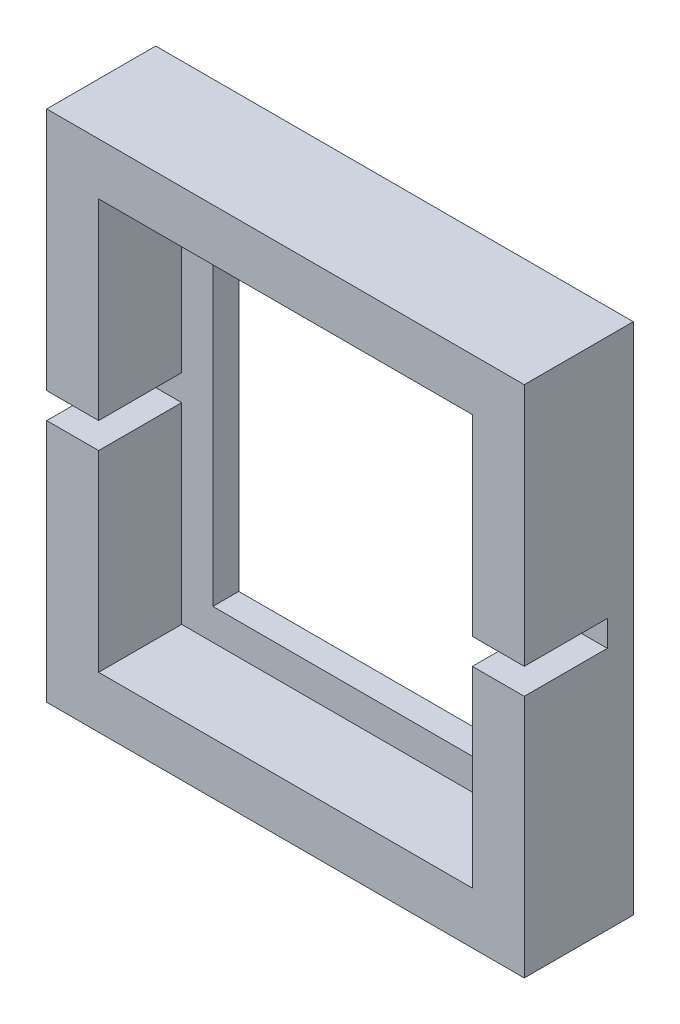
from build123d import *

# Parameters (mm, degrees)
BOSS_EXTRUDE1_DEPTH   = 8
BOSS_EXTRUDE1_2_DEPTH = 8
SKETCH2_W             = 46
SKETCH2_H             = 49.5
SKETCH2_W_2           = 30
SKETCH2_H_2           = 33.5
BOSS_EXTRUDE2_DEPTH   = 2.5


with BuildPart() as part:
    # Sketch1 → Boss-Extrude1 (new body)
    with BuildSketch(Plane.XY):
        Polygon((-5, 21), (0, 21), (0, 39.5), (36, 39.5), (36, 21), (41, 21), (41, 44.5), (-5, 44.5), align=None)
    extrude(amount=BOSS_EXTRUDE1_DEPTH)



with BuildPart() as body_2:
    # Sketch1 → Boss-Extrude1 2 (new body)
    with BuildSketch(Plane.XY):
        Polygon((36, 0), (0, 0), (0, 18.5), (-5, 18.5), (-5, -5), (41, -5), (41, 18.5), (36, 18.5), align=None)
    extrude(amount=BOSS_EXTRUDE1_2_DEPTH)


with BuildPart() as part_1:
    add(part.part)

    add(body_2.part)  # Boss-Extrude2 merges body 2
    # Sketch2 → Boss-Extrude2 (add)
    with BuildSketch(Plane(origin=(0, 0, 0), x_dir=(-1, 0, 0), z_dir=(0, 0, -1))):
        with Locations((-18, 19.75)):
            Rectangle(SKETCH2_W, SKETCH2_H)
        with Locations((-18, 19.75)):
            Rectangle(SKETCH2_W_2, SKETCH2_H_2, mode=Mode.SUBTRACT)
    extrude(amount=BOSS_EXTRUDE2_DEPTH)


solid = part_1.part
